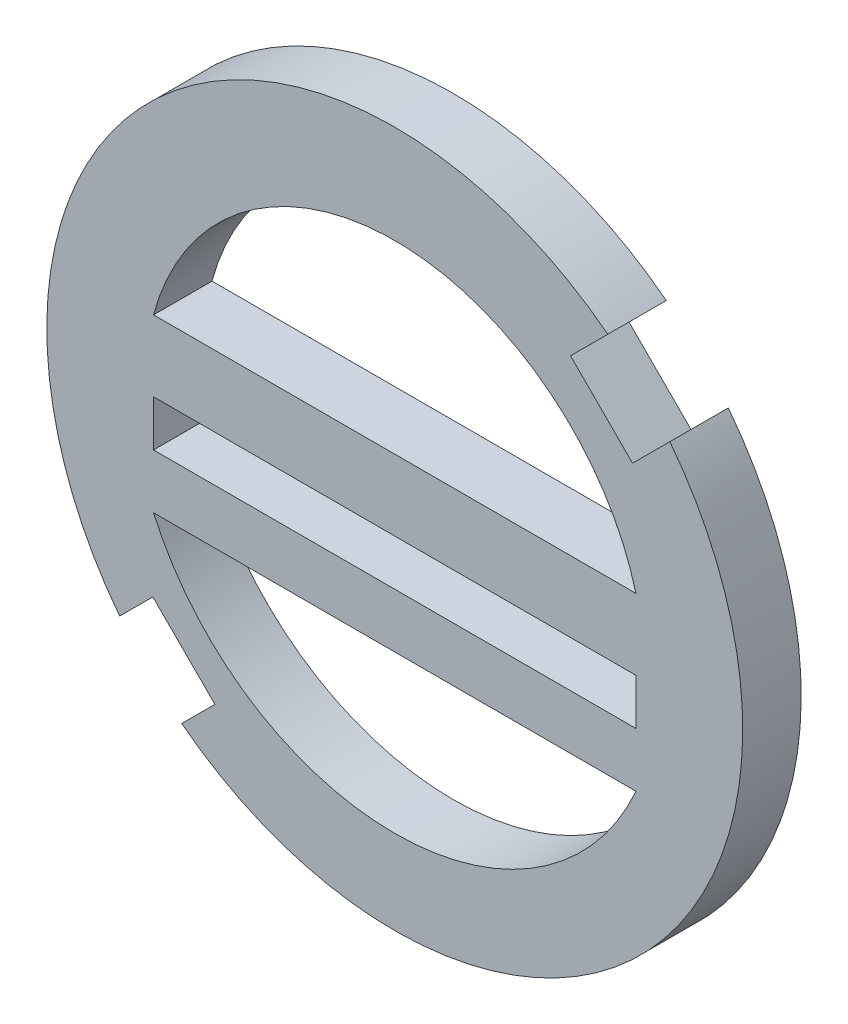
from build123d import *

# Parameters (mm, degrees)
SKETCH1_R           = 75.565
SKETCH1_W           = 104.775
SKETCH1_H           = 10
BOSS_EXTRUDE1_DEPTH = 12.7
CUT_EXTRUDE1_DEPTH  = 12.7


with BuildPart() as part:
    # Sketch1 → Boss-Extrude1 (new body)
    with BuildSketch(Plane.XY):
        Circle(SKETCH1_R)
        with BuildLine():
            Line((-52.3875, 14.055637656), (52.3875, 14.055637656))
            ThreePointArc((52.3875, 14.055637656), (0, 54.240308869), (-52.3875, 14.055637656))
        make_face(mode=Mode.SUBTRACT)
        with Locations((0, -6.35)):
            Rectangle(SKETCH1_W, SKETCH1_H, mode=Mode.SUBTRACT)
        with BuildLine():
            Line((-52.3875, -23.154456235), (52.3875, -23.154456235))
            ThreePointArc((52.3875, -23.154456235), (0, -57.276338917), (-52.3875, -23.154456235))
        make_face(mode=Mode.SUBTRACT)
    extrude(amount=BOSS_EXTRUDE1_DEPTH)

    # Sketch3 → Cut-Extrude1 (cut)
    with BuildSketch(Plane.XY.offset(12.7)):
        Polygon((47.146344636, 60.616728817), (60.616728817, 47.146344636), (51.636472696, 38.166088515), (38.166088515, 51.636472696), align=None)
        Polygon((-52.534498308, -39.064114127), (-39.064114127, -52.534498308), (-48.044370248, -61.514754429), (-61.514754429, -48.044370248), align=None)
    extrude(amount=-CUT_EXTRUDE1_DEPTH, mode=Mode.SUBTRACT)


solid = part.part
